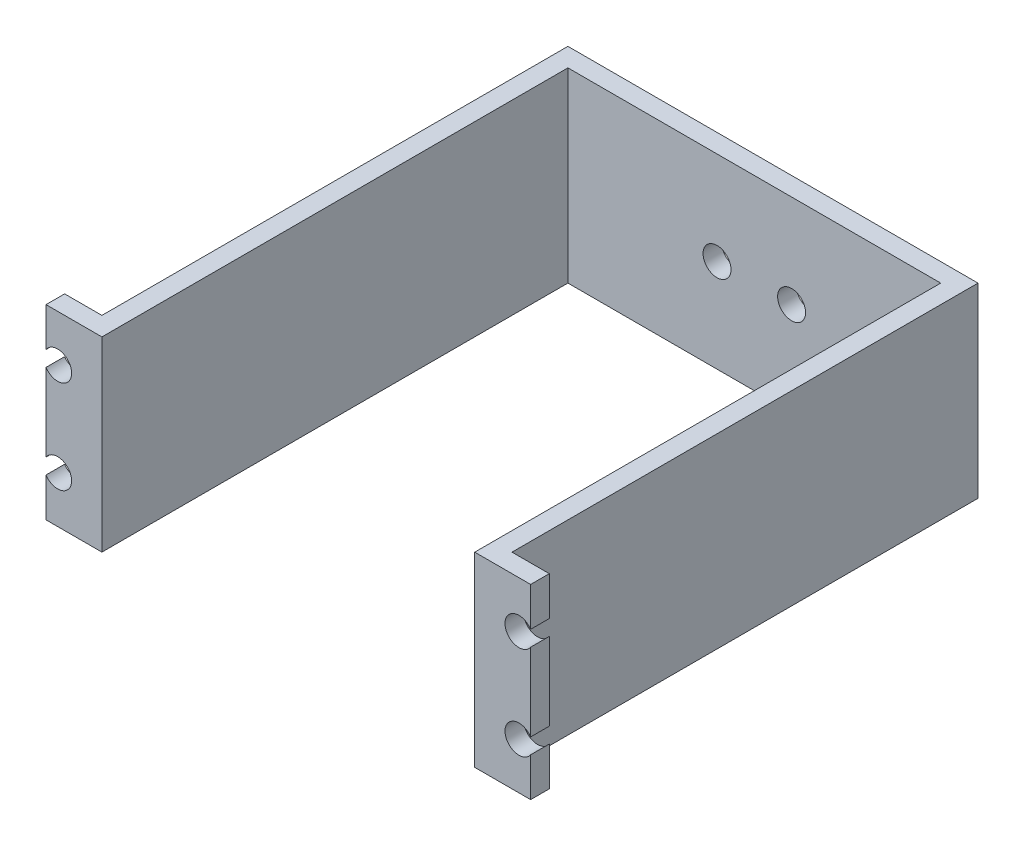
from build123d import *

# Parameters (mm, degrees)
ESQUISSE1_W             = 44
ESQUISSE1_H             = 20
BOSS_EXTRU_1_DEPTH      = 2
ESQUISSE2_W             = 2
ESQUISSE2_H             = 20
BOSS_EXTRU_2_DEPTH      = 50
ESQUISSE3_W             = 2
ESQUISSE3_H             = 20
BOSS_EXTRU_3_DEPTH      = 4
ESQUISSE4_W             = 2
ESQUISSE4_H             = 20
BOSS_EXTRU_4_DEPTH      = 4
ESQUISSE5_R             = 1.5
ENL_V_MAT_EXTRU_1_DEPTH = 4
ESQUISSE6_R             = 1.5
ENL_V_MAT_EXTRU_2_DEPTH = 4


with BuildPart() as part:
    # Esquisse1 → Boss.-Extru.1 (new body)
    with BuildSketch(Plane.XY):
        with Locations((22, 10)):
            Rectangle(ESQUISSE1_W, ESQUISSE1_H)
    extrude(amount=BOSS_EXTRU_1_DEPTH)

    # Esquisse2 → Boss.-Extru.2 (add)
    with BuildSketch(Plane.XY.offset(2)):
        with Locations((1, 10)):
            Rectangle(ESQUISSE2_W, ESQUISSE2_H)
        with Locations((43, 10)):
            Rectangle(ESQUISSE2_W, ESQUISSE2_H)
    extrude(amount=BOSS_EXTRU_2_DEPTH)

    # Esquisse3 → Boss.-Extru.3 (add)
    with BuildSketch(Plane.ZY):
        with Locations((51, 10)):
            Rectangle(ESQUISSE3_W, ESQUISSE3_H)
    extrude(amount=BOSS_EXTRU_3_DEPTH)

    # Esquisse4 → Boss.-Extru.4 (add)
    with BuildSketch(Plane(origin=(44, 0, 0), x_dir=(0, 0, -1), z_dir=(1, 0, 0))):
        with Locations((-51, 10)):
            Rectangle(ESQUISSE4_W, ESQUISSE4_H)
    extrude(amount=BOSS_EXTRU_4_DEPTH)

    # Esquisse5 → Enlèv. mat.-Extru.1 (cut)
    with BuildSketch(Plane.XY.offset(2)):
        with Locations((18, 10)):
            Circle(ESQUISSE5_R)
        with Locations((26, 10)):
            Circle(ESQUISSE5_R)
    extrude(amount=-ENL_V_MAT_EXTRU_1_DEPTH, mode=Mode.SUBTRACT)

    # Esquisse6 → Enlèv. mat.-Extru.2 (cut)
    with BuildSketch(Plane.XY.offset(52)):
        with Locations((46.75, 15)):
            Circle(ESQUISSE6_R)
        with Locations((46.75, 5)):
            Circle(ESQUISSE6_R)
        with Locations((-2.75, 15)):
            Circle(ESQUISSE6_R)
        with Locations((-2.75, 5)):
            Circle(ESQUISSE6_R)
    extrude(amount=-ENL_V_MAT_EXTRU_2_DEPTH, mode=Mode.SUBTRACT)


solid = part.part
